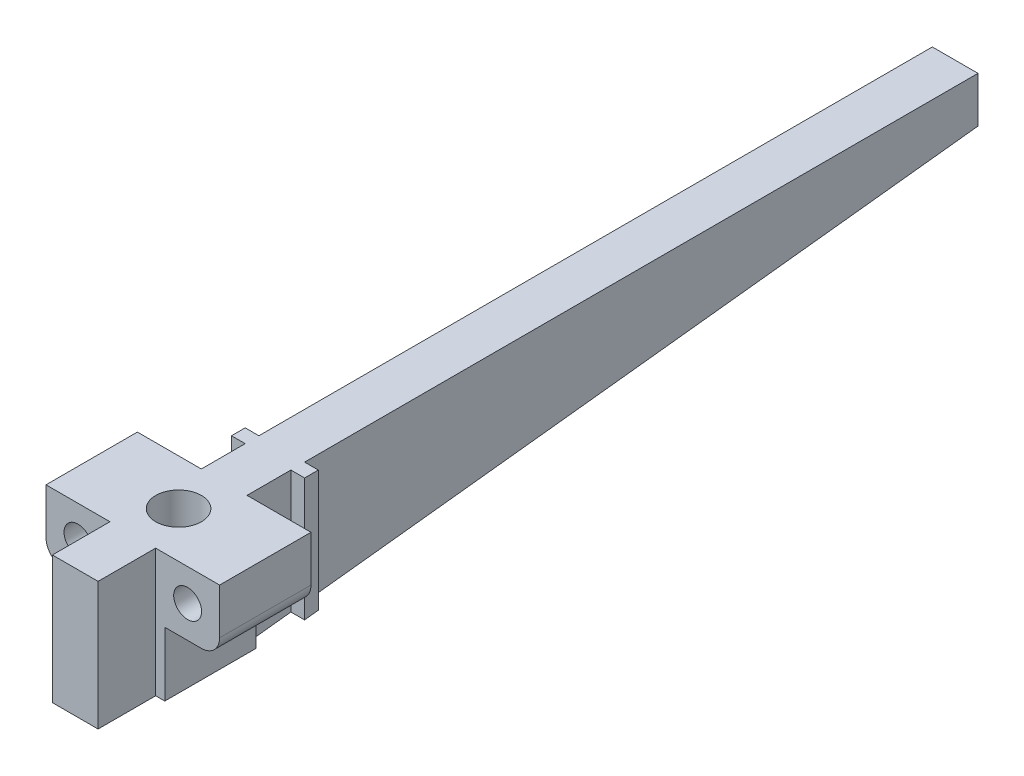
from build123d import *

# Parameters (mm, degrees)
SKETCH_1_R           = 1.525
EXTRUDE_1_DEPTH      = 10
EXTRUDE_2_DEPTH      = 2.5
EXTRUDE_2_DEPTH_BACK = 2.5
SKETCH_4_W           = 5
SKETCH_4_H           = 14
EXTRUDE_3_DEPTH      = 6.3
CUT_EXTRUDE_1_REACH  = 84.481
SKETCH_5_R           = 2.5
EXTRUDE_5_DEPTH      = 1.5


with BuildPart() as part:
    # 草图1 → 凸台-拉伸1 (new body)
    with BuildSketch(Plane.XY):
        with BuildLine():
            Line((-4.609526623, 6.301360946), (-4.609526623, 1.301360946))
            ThreePointArc((-4.609526623, 1.301360946), (-4.023740186, -0.112852616), (-2.609526623, -0.698639054))
            Line((-2.609526623, -0.698639054), (1.390473377, -0.698639054))
            Line((1.390473377, -0.698639054), (1.390473377, -7.698639054))
            Line((1.390473377, -7.698639054), (8.390473377, -7.698639054))
            Line((8.390473377, -7.698639054), (8.390473377, -0.698639054))
            Line((8.390473377, -0.698639054), (12.390473377, -0.698639054))
            ThreePointArc((12.390473377, -0.698639054), (13.804686939, -0.112852616), (14.390473377, 1.301360946))
            Line((14.390473377, 1.301360946), (14.390473377, 6.301360946))
            Line((14.390473377, 6.301360946), (-4.609526623, 6.301360946))
        make_face()
        with Locations((10.890473377, 2.801360946)):
            Circle(SKETCH_1_R, mode=Mode.SUBTRACT)
        with Locations((-1.109526623, 2.801360946)):
            Circle(SKETCH_1_R, mode=Mode.SUBTRACT)
    extrude(amount=EXTRUDE_1_DEPTH)

    # 草图3 → 凸台-拉伸2 (add, two sides: drawn at the far end of the back side and taken through both)
    with BuildSketch(Plane(origin=(4.890473377, 0, 0), x_dir=(0, 0, -1), z_dir=(1, 0, 0)).offset(-EXTRUDE_2_DEPTH_BACK)):
        Polygon((0, 6.301360946), (80, 6.301360946), (80, 1.301360946), (0, -7.698639054), align=None)
    extrude(amount=EXTRUDE_2_DEPTH + EXTRUDE_2_DEPTH_BACK)

    # 草图4 → 凸台-拉伸3 (add)
    with BuildSketch(Plane.XY.offset(10)):
        with Locations((4.890473377, -0.698639054)):
            Rectangle(SKETCH_4_W, SKETCH_4_H)
    extrude(amount=EXTRUDE_3_DEPTH)

    # 草图5 → 切除-拉伸1 (cut, up to next)
    with BuildSketch(Plane(origin=(0, 6.301360946, 0), x_dir=(1, 0, 0), z_dir=(0, 1, 0)), mode=Mode.PRIVATE) as cut_extrude_1_sk1:
        with Locations(Location((4.900882763, -5, 0), (0, 0, 270))):
            Circle(SKETCH_5_R)
    cut_extrude_1_tool1 = extrude(cut_extrude_1_sk1.sketch, amount=-CUT_EXTRUDE_1_REACH, mode=Mode.PRIVATE) & part.part
    add(cut_extrude_1_tool1.solids().sort_by_distance((4.900883, 6.301361, 5))[0], mode=Mode.SUBTRACT)

    # 草图6 → 凸台-拉伸5 (add)
    with BuildSketch(Plane(origin=(7.390473377, 0, 0), x_dir=(0, 0, -1), z_dir=(1, 0, 0))):
        Polygon((6.3, 6.301360946), (4.8, 6.301360946), (4.8, -7.158639054), (6.3, -6.989889054), align=None)
    extrude_5 = extrude(amount=EXTRUDE_5_DEPTH)

    # 镜向1: 凸台-拉伸5 across plane
    add(extrude_5.mirror(Plane(origin=(4.890473377, 0, 0), x_dir=(0, 0, 1), z_dir=(1, 0, 0))))


solid = part.part
